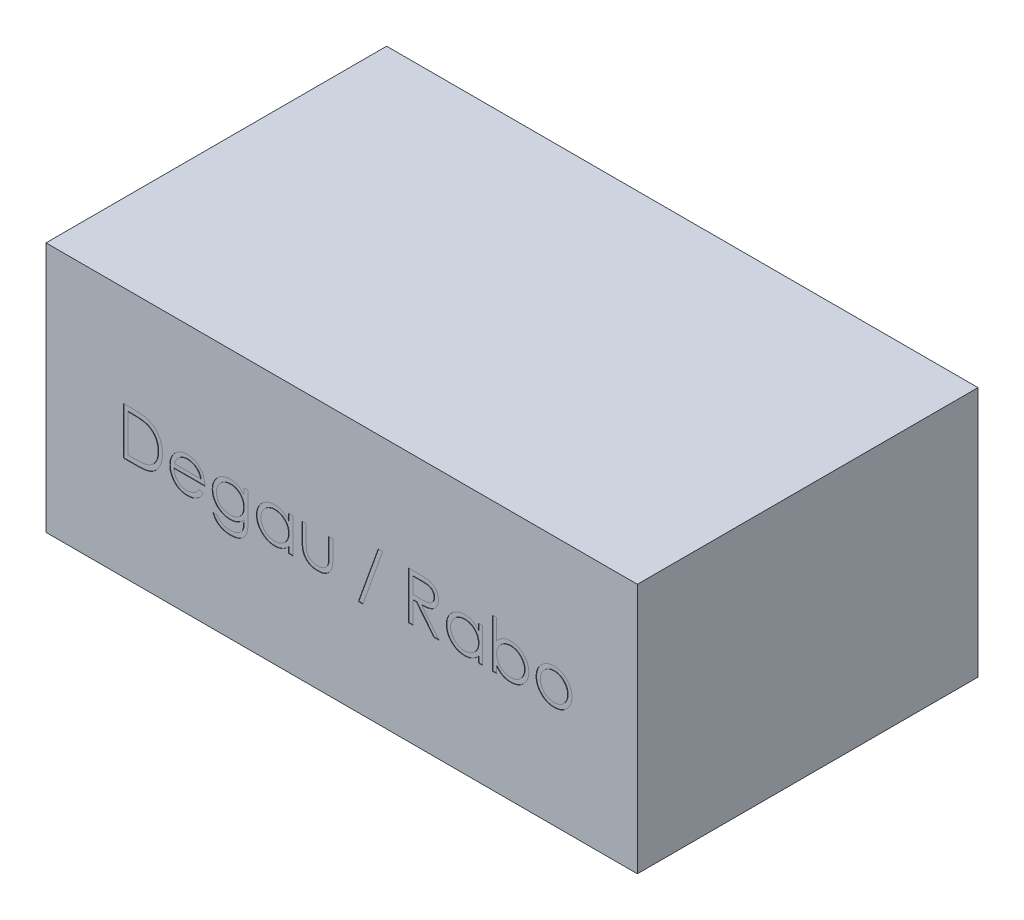
from build123d import *

# Parameters (mm, degrees)
ESQUISSE1_W             = 1250
ESQUISSE1_H             = 530
BOSS_EXTRU_1_DEPTH      = 720
ENL_V_MAT_EXTRU_1_DEPTH = 1


with BuildPart() as part:
    # Esquisse1 → Boss.-Extru.1 (new body)
    with BuildSketch(Plane.XY):
        with Locations((625, 265)):
            Rectangle(ESQUISSE1_W, ESQUISSE1_H)
    extrude(amount=BOSS_EXTRU_1_DEPTH)

    # Esquisse2 → Enlèv. mat.-Extru.1 (cut)
    # profile 1 of 10: a face of its own
    with BuildSketch(Plane.XY.offset(720)):
        with BuildLine():
            Line((164.157647169, 217.891840337), (164.157647169, 317.891840337))
            Line((164.157647169, 317.891840337), (184.349954861, 317.891840337))
            add(Edge.make_bspline(
                [(184.349954861, 317.891840337), (186.106211667, 317.87919548), (189.499290676, 317.854765682), (194.40250346, 317.699868792), (198.939182388, 317.425855482), (203.094406933, 317.026726164), (206.879584419, 316.536639489), (210.284116079, 315.922342222), (213.325605876, 315.196965926), (215.196161322, 314.57852449), (216.080724092, 314.286071106)],
                knots=[0, 0, 0, 0, 1.314313732, 2.53924729, 3.670748893, 4.714932338, 5.66265055, 6.526160246, 7.303039223, 8, 8, 8, 8], degree=3))
            add(Edge.make_bspline(
                [(216.080724092, 314.286071106), (217.237716644, 313.845193802), (219.525464995, 312.973436828), (222.782811354, 311.328971076), (225.849250296, 309.465739598), (228.741225863, 307.381286378), (231.392678046, 305.016590707), (233.907189382, 302.472102546), (236.181895776, 299.655292826), (238.264989948, 296.624578883), (240.143151647, 293.415663106), (241.775699014, 290.03466), (243.131527395, 286.49873977), (244.257048155, 282.817735541), (245.144089799, 278.983553318), (245.749287848, 274.991728574), (246.148458987, 270.858037448), (246.188574739, 268.05305277), (246.20892922, 266.629821106)],
                knots=[0, 0, 0, 0, 0.984719456, 1.947108742, 2.898477687, 3.838006223, 4.779231079, 5.722358779, 6.681677486, 7.655904652, 8.64651281, 9.637519902, 10.640069247, 11.656948941, 12.698408672, 13.768548281, 14.867775369, 16, 16, 16, 16], degree=3))
            add(Edge.make_bspline(
                [(246.20892922, 266.629821106), (246.190958721, 265.393785721), (246.155545975, 262.958048894), (245.837565521, 259.368309019), (245.375384949, 255.885064124), (244.659836439, 252.524901265), (243.791193198, 249.258380754), (242.677931732, 246.12031663), (241.402631842, 243.081922078), (239.915492454, 240.184279909), (238.282881454, 237.4390407), (236.530831648, 234.851168468), (234.66121178, 232.457590702), (232.656193697, 230.251058929), (230.541687513, 228.234899546), (228.303849496, 226.392270536), (225.936905189, 224.759226112), (223.451455967, 223.271594449), (220.774995133, 221.973870005), (217.856827527, 220.875869725), (214.684508156, 219.965966429), (211.265823673, 219.206797978), (207.594867166, 218.604589331), (203.668039571, 218.200978118), (199.491374151, 217.928037184), (196.623395144, 217.904140231), (195.147230502, 217.891840337)],
                knots=[0, 0, 0, 0, 1.105936401, 2.179363191, 3.223086493, 4.248585256, 5.251745608, 6.245858792, 7.225916811, 8.198733463, 9.158002045, 10.082870192, 10.993790845, 11.873723703, 12.748670949, 13.606408763, 14.465103618, 15.319838547, 16.196477973, 17.123216899, 18.106603292, 19.147568657, 20.255746949, 21.433717677, 22.679120308, 24, 24, 24, 24], degree=3))
            Line((195.147230502, 217.891840337), (164.157647169, 217.891840337))
        make_face()
        with BuildLine():
            Line((173.132006143, 228.148250594), (184.610371528, 228.148250594))
            add(Edge.make_bspline(
                [(184.610371528, 228.148250594), (186.259753549, 228.155339061), (189.432119218, 228.168972781), (193.993776283, 228.288607156), (198.16175904, 228.484091085), (201.936659308, 228.757664737), (205.316345717, 229.11962517), (208.307881428, 229.52319382), (210.901460237, 230.025978128), (212.470872721, 230.481719825), (213.196108707, 230.692321106)],
                knots=[0, 0, 0, 0, 1.375205317, 2.645023457, 3.804390687, 4.853969522, 5.800190428, 6.637939096, 7.370582563, 8, 8, 8, 8], degree=3))
            add(Edge.make_bspline(
                [(213.196108707, 230.692321106), (214.108919053, 231.013794199), (215.912737286, 231.649062006), (218.509339721, 232.807852326), (220.930968425, 234.18048289), (223.219826291, 235.706262147), (225.343445017, 237.439005061), (227.326991197, 239.341033313), (229.166471236, 241.422026886), (230.842880036, 243.679402931), (232.343117294, 246.099111378), (233.642295277, 248.657363769), (234.780910466, 251.326129775), (235.67458454, 254.146391451), (236.375029802, 257.092935977), (236.871163744, 260.165970642), (237.180155871, 263.364921552), (237.216197241, 265.540696531), (237.234570246, 266.649853158)],
                knots=[0, 0, 0, 0, 0.998632004, 1.973411704, 2.929992603, 3.868527914, 4.809262121, 5.754881198, 6.702106254, 7.672490631, 8.653608572, 9.636854334, 10.631411391, 11.644891563, 12.686317036, 13.754757253, 14.855430412, 16, 16, 16, 16], degree=3))
            add(Edge.make_bspline(
                [(237.234570246, 266.649853158), (237.219904893, 267.819381166), (237.191094676, 270.116929291), (236.828971521, 273.488092013), (236.299784221, 276.730396314), (235.534536049, 279.844059039), (234.559368082, 282.835154816), (233.342378317, 285.687140821), (231.951903481, 288.430137075), (230.297522429, 291.000833239), (228.485648333, 293.432064928), (226.47485178, 295.65934823), (224.297079251, 297.68775681), (221.976083552, 299.548880029), (219.446452145, 301.167842197), (216.767775265, 302.616033085), (213.900756089, 303.845058552), (211.906107636, 304.498740345), (210.89242281, 304.830942901)],
                knots=[0, 0, 0, 0, 1.122418816, 2.205001699, 3.251619955, 4.274784885, 5.280384055, 6.268708349, 7.249350384, 8.229342522, 9.199999885, 10.157847722, 11.105861043, 12.055065948, 13.010012805, 13.98527497, 14.976112212, 16, 16, 16, 16], degree=3))
            add(Edge.make_bspline(
                [(210.89242281, 304.830942901), (210.053818628, 305.06284084), (208.270716048, 305.555919485), (205.361017076, 306.093787271), (202.086298521, 306.568201529), (198.432021347, 306.969859796), (194.402351087, 307.258068977), (189.994188573, 307.474392252), (185.205628442, 307.620296037), (181.886127475, 307.6302591), (180.163256143, 307.635430081)],
                knots=[0, 0, 0, 0, 0.674548936, 1.434276114, 2.292660221, 3.240891867, 4.284742987, 5.42552168, 6.663806718, 8, 8, 8, 8], degree=3))
            Line((180.163256143, 307.635430081), (173.132006143, 307.635430081))
            Line((173.132006143, 307.635430081), (173.132006143, 228.148250594))
        make_face(mode=Mode.SUBTRACT)
    # profile 2 of 10: a face of its own
    with BuildSketch(Plane.XY.offset(720)):
        with BuildLine():
            Line((324.133608707, 240.968763414), (332.106365118, 236.782064696))
            add(Edge.make_bspline(
                [(332.106365118, 236.782064696), (331.471033825, 235.655112374), (330.234930726, 233.462509436), (328.109195072, 230.450170566), (325.880850141, 227.740235827), (323.449308198, 225.405102848), (320.887317371, 223.369348991), (318.180670091, 221.588268285), (315.315275299, 220.070596275), (312.290997448, 218.791952622), (309.082438844, 217.808824219), (305.681824089, 217.114417907), (302.082638507, 216.68518166), (299.615604796, 216.635320494), (298.352358707, 216.609789055)],
                knots=[0, 0, 0, 0, 1.120438281, 2.179929193, 3.190490725, 4.156257408, 5.095198341, 6.022838206, 6.959905092, 7.901321166, 8.864066838, 9.862729781, 10.905609505, 12, 12, 12, 12], degree=3))
            add(Edge.make_bspline(
                [(298.352358707, 216.609789055), (296.948302206, 216.642565493), (294.209394731, 216.706502828), (290.222544813, 217.257716098), (286.468847145, 218.156926346), (282.948512763, 219.413084674), (279.670162689, 221.053865363), (276.627281123, 223.0527077), (273.803866098, 225.399343548), (271.288888693, 228.114099076), (269.024777759, 231.019297856), (267.026897188, 234.046608842), (265.356684872, 237.188415255), (263.998038867, 240.424715942), (262.90075701, 243.7351129), (262.135994045, 247.14972626), (261.695144103, 250.659314381), (261.627588516, 253.033523973), (261.593544605, 254.229981363)],
                knots=[0, 0, 0, 0, 1.145258523, 2.234067595, 3.276747158, 4.290159414, 5.277019952, 6.260822364, 7.254936242, 8.264827045, 9.274100331, 10.257902744, 11.220704747, 12.172965371, 13.118907548, 14.062713208, 15.023725156, 16, 16, 16, 16], degree=3))
            add(Edge.make_bspline(
                [(261.593544605, 254.229981363), (261.623805786, 255.352690803), (261.68377945, 257.577752651), (262.061801947, 260.871053924), (262.731753177, 264.071866853), (263.651076719, 267.182851081), (264.838255181, 270.198797766), (266.290604302, 273.121542441), (268.010386524, 275.947975008), (269.338177203, 277.730921686), (270.007006143, 278.629019824)],
                knots=[0, 0, 0, 0, 1.024358464, 2.0301432, 3.019427413, 4.004406732, 4.986367066, 5.972626655, 6.978780325, 8, 8, 8, 8], degree=3))
            add(Edge.make_bspline(
                [(270.007006143, 278.629019824), (270.912939937, 279.710987541), (272.69610984, 281.840648983), (275.712005707, 284.638886862), (278.977725603, 286.982994724), (282.452343491, 288.926055757), (286.17624275, 290.402445671), (290.099365351, 291.502662306), (294.266382101, 292.119176907), (297.115102696, 292.206257868), (298.572711272, 292.250814696)],
                knots=[0, 0, 0, 0, 1.030682036, 2.02871468, 2.997146059, 3.962720338, 4.930598197, 5.918074684, 6.934738563, 8, 8, 8, 8], degree=3))
            add(Edge.make_bspline(
                [(298.572711272, 292.250814696), (300.07121428, 292.212127585), (303.010935593, 292.136232292), (307.297567622, 291.432622766), (311.353588095, 290.316835492), (315.177373932, 288.741012907), (318.769312811, 286.707882855), (322.106057085, 284.189544527), (325.244671729, 281.263313464), (327.070631125, 279.012936052), (327.999794605, 277.867801876)],
                knots=[0, 0, 0, 0, 1.056321875, 2.072262726, 3.055038591, 4.01806755, 4.982017516, 5.957941055, 6.960871419, 8, 8, 8, 8], degree=3))
            add(Edge.make_bspline(
                [(327.999794605, 277.867801876), (328.631992842, 277.004842407), (329.892181217, 275.284667588), (331.470669789, 272.479777385), (332.840881074, 269.545188975), (333.936108532, 266.433466201), (334.822951423, 263.181478196), (335.464574816, 259.765976918), (335.840849632, 256.187979451), (335.914812414, 253.750077866), (335.952518964, 252.507224952)],
                knots=[0, 0, 0, 0, 0.94817472, 1.890038105, 2.849395472, 3.817997239, 4.812318967, 5.836947057, 6.897266129, 8, 8, 8, 8], degree=3))
            Line((335.952518964, 252.507224952), (270.567903579, 252.507224952))
            add(Edge.make_bspline(
                [(270.567903579, 252.507224952), (270.611892334, 251.544354545), (270.698394447, 249.650908724), (271.101684252, 246.880314922), (271.737363503, 244.241076574), (272.630765292, 241.752989661), (273.712675157, 239.383557446), (275.037981351, 237.15035639), (276.619111464, 235.063558388), (278.382702875, 233.104497314), (280.345762741, 231.359904138), (282.41098409, 229.798424817), (284.60794309, 228.489693482), (286.919316904, 227.427410917), (289.341367908, 226.595801887), (291.874859197, 226.028149868), (294.514805379, 225.647946814), (296.31439778, 225.605670665), (297.230563836, 225.584148029)],
                knots=[0, 0, 0, 0, 1.094153842, 2.151609401, 3.174256925, 4.172055639, 5.149267565, 6.128595816, 7.11444997, 8.118368179, 9.117203808, 10.09244225, 11.054858984, 12.015122123, 12.976791628, 13.957293641, 14.960065497, 16, 16, 16, 16], degree=3))
            add(Edge.make_bspline(
                [(297.230563836, 225.584148029), (298.12631091, 225.601521077), (299.903644937, 225.635992536), (302.550526575, 225.97118999), (305.154513072, 226.513197865), (307.70482688, 227.252911867), (310.149708192, 228.155107642), (312.413866765, 229.243760718), (314.49615864, 230.448039196), (316.442357685, 231.825458483), (318.330100352, 233.511406683), (320.202742821, 235.615284426), (322.210647203, 238.103499505), (323.46749271, 239.976232819), (324.133608707, 240.968763414)],
                knots=[0, 0, 0, 0, 0.99110716, 1.966546729, 2.947904876, 3.932708344, 4.903319531, 5.828989031, 6.710028674, 7.56322171, 8.463672341, 9.504779593, 10.677557249, 12, 12, 12, 12], degree=3))
        make_face()
        with BuildLine():
            add(Edge.make_bspline(
                [(326.97815999, 261.481583927), (326.649685002, 262.671951748), (326.017476388, 264.963026621), (324.696437404, 268.135623491), (323.208679099, 270.955277806), (321.448058202, 273.400410179), (319.45323747, 275.571939121), (317.149089394, 277.469612983), (314.565206723, 279.167254442), (311.714945561, 280.600182998), (308.696608844, 281.819893247), (305.536431931, 282.637753697), (302.311923706, 283.198026334), (300.130944096, 283.250200861), (299.033448451, 283.276455722)],
                knots=[0, 0, 0, 0, 1.154881502, 2.222775134, 3.210006277, 4.132804581, 5.035138423, 5.962687519, 6.919655026, 7.923214229, 8.944639381, 9.960483929, 10.97369054, 12, 12, 12, 12], degree=3))
            add(Edge.make_bspline(
                [(299.033448451, 283.276455722), (298.137750208, 283.258979392), (296.367143092, 283.224432362), (293.758541144, 282.896714381), (291.253406889, 282.355004528), (288.833255814, 281.613148625), (286.529802432, 280.62433141), (284.295666197, 279.46481065), (282.187654876, 278.049336827), (280.869332148, 276.970512403), (280.203320246, 276.425494183)],
                knots=[0, 0, 0, 0, 1.04873581, 2.073130211, 3.073294108, 4.04793562, 5.032784715, 6.005352987, 6.992311501, 8, 8, 8, 8], degree=3))
            add(Edge.make_bspline(
                [(280.203320246, 276.425494183), (279.726369333, 275.994228023), (278.761136926, 275.121450421), (277.471407741, 273.617758805), (276.236537093, 271.996285601), (275.112718442, 270.194996326), (274.081930258, 268.234402641), (273.117359481, 266.131041634), (272.249176279, 263.868952198), (271.760715992, 262.292596791), (271.50940999, 261.481583927)],
                knots=[0, 0, 0, 0, 0.879870761, 1.780643979, 2.707998968, 3.669668524, 4.684282772, 5.740141944, 6.837334558, 8, 8, 8, 8], degree=3))
            Line((271.50940999, 261.481583927), (326.97815999, 261.481583927))
        make_face(mode=Mode.SUBTRACT)
    # profile 3 of 10: a face of its own
    with BuildSketch(Plane.XY.offset(720)):
        with BuildLine():
            Line((418.003801015, 290.968763414), (426.97815999, 290.968763414))
            Line((426.97815999, 290.968763414), (426.97815999, 232.975974952))
            add(Edge.make_bspline(
                [(426.97815999, 232.975974952), (426.970244487, 231.740615107), (426.954965662, 229.356073029), (426.844937912, 225.908122183), (426.612918563, 222.723376882), (426.349813381, 219.787312351), (425.971335772, 217.113537778), (425.509153851, 214.694074787), (424.988134446, 212.526601577), (424.530413948, 211.191606119), (424.313897169, 210.560109568)],
                knots=[0, 0, 0, 0, 1.307562039, 2.523909702, 3.650326591, 4.686913197, 5.643429486, 6.506965704, 7.293745905, 8, 8, 8, 8], degree=3))
            add(Edge.make_bspline(
                [(424.313897169, 210.560109568), (423.994204634, 209.739254665), (423.364378164, 208.122087893), (422.184788636, 205.829678727), (420.863819962, 203.671210446), (419.355055658, 201.658711837), (417.6653184, 199.80228577), (415.834418624, 198.061600076), (413.826698869, 196.473481008), (411.643307092, 195.065329652), (409.334574714, 193.797128105), (406.901828941, 192.698654757), (404.358787845, 191.741887796), (401.681562371, 191.025236489), (398.9121271, 190.404244473), (396.017914784, 190.000110593), (393.015834875, 189.72505179), (390.974538301, 189.699616562), (389.938897169, 189.686712132)],
                knots=[0, 0, 0, 0, 0.981931301, 1.934503488, 2.87077864, 3.801706999, 4.735015492, 5.667491629, 6.616593066, 7.585388521, 8.561939025, 9.551802639, 10.560317337, 11.588439944, 12.640189604, 13.723962949, 14.845264515, 16, 16, 16, 16], degree=3))
            add(Edge.make_bspline(
                [(389.938897169, 189.686712132), (388.427904752, 189.711183155), (385.476530602, 189.758981638), (381.173530811, 190.315864926), (377.086824528, 191.103132728), (373.270411479, 192.294716375), (369.748408711, 193.752916082), (366.544869411, 195.427057595), (363.688552053, 197.346752132), (361.113589967, 199.532483587), (358.789544535, 202.131445919), (356.603050535, 205.194270037), (354.498452196, 208.767609727), (353.265062543, 211.390258676), (352.619185631, 212.763635209)],
                knots=[0, 0, 0, 0, 1.157897085, 2.2616841, 3.32207898, 4.345638746, 5.321241055, 6.241986252, 7.112515963, 7.955008012, 8.825025602, 9.77857164, 10.836726669, 12, 12, 12, 12], degree=3))
            Line((352.619185631, 212.763635209), (361.593544605, 212.763635209))
            add(Edge.make_bspline(
                [(361.593544605, 212.763635209), (362.315322014, 211.617753044), (363.726307968, 209.377694515), (366.364835996, 206.477318632), (369.25644532, 203.998651069), (372.498721982, 202.001200382), (376.105156708, 200.495206342), (380.07791917, 199.421626443), (384.449336934, 198.778875962), (387.492714482, 198.701410415), (389.077518964, 198.661071106)],
                knots=[0, 0, 0, 0, 0.997731894, 1.950442991, 2.880492273, 3.800895997, 4.748200782, 5.754801363, 6.83083817, 8, 8, 8, 8], degree=3))
            add(Edge.make_bspline(
                [(389.077518964, 198.661071106), (390.642287259, 198.7019325), (393.659003907, 198.780709178), (397.997037308, 199.421913298), (401.956892681, 200.495439976), (405.515755556, 201.998536726), (408.631634657, 203.839976913), (411.317691551, 205.897121896), (413.493253727, 208.216579125), (414.956481346, 210.353202156), (415.866041849, 212.256748719), (416.445248613, 213.895394318), (416.915933455, 215.74833368), (417.309643099, 217.809354715), (417.634526338, 220.081402059), (417.840322977, 222.569670727), (417.98906045, 225.268505651), (417.998773874, 227.139738171), (418.003801015, 228.108186491)],
                knots=[0, 0, 0, 0, 1.570740765, 3.028230971, 4.391408896, 5.680370741, 6.894727393, 8.017376726, 9.065722033, 10.075533815, 10.603371122, 11.180248986, 11.817768598, 12.521299649, 13.286540596, 14.121245857, 15.027658897, 16, 16, 16, 16], degree=3))
            Line((418.003801015, 228.108186491), (418.003801015, 231.894244183))
            add(Edge.make_bspline(
                [(418.003801015, 231.894244183), (417.092911947, 230.810192693), (415.287156069, 228.661157846), (412.168661008, 225.845111083), (408.762463418, 223.419793075), (405.074362207, 221.430689232), (401.194698145, 219.839791386), (397.165491562, 218.72713536), (393.022861413, 218.008281077), (390.215657132, 217.930929185), (388.797070246, 217.891840337)],
                knots=[0, 0, 0, 0, 1.012485704, 2.007162095, 2.997754123, 3.998611389, 4.999708251, 5.992315798, 6.98544096, 8, 8, 8, 8], degree=3))
            add(Edge.make_bspline(
                [(388.797070246, 217.891840337), (387.961748262, 217.906555379), (386.300989475, 217.935811326), (383.833710983, 218.191776395), (381.402841316, 218.563169032), (379.014049784, 219.108353003), (376.663889411, 219.808116618), (374.356243922, 220.682880583), (372.072428877, 221.671883962), (369.853957509, 222.836821203), (367.722925203, 224.132887113), (365.695405627, 225.536855419), (363.782018796, 227.04137794), (362.000976241, 228.661290506), (360.354614199, 230.394248585), (358.820789398, 232.221778671), (357.424865196, 234.169399853), (356.138196932, 236.201598639), (355.022266921, 238.331910748), (354.04271344, 240.514142046), (353.191016153, 242.74362646), (352.512004675, 245.02782825), (351.993401439, 247.365307361), (351.607394954, 249.752234471), (351.388454049, 252.195959832), (351.354313362, 253.842284095), (351.337134348, 254.670686491)],
                knots=[0, 0, 0, 0, 1.028754217, 2.045334182, 3.052854819, 4.056607503, 5.061168794, 6.071104265, 7.095078842, 8.125279047, 9.155117945, 10.165957491, 11.161587969, 12.151493252, 13.128948131, 14.104219989, 15.088194871, 16.07871515, 17.064853787, 18.047899887, 19.02414258, 20.002704429, 20.980574569, 21.971845993, 22.979467364, 24, 24, 24, 24], degree=3))
            add(Edge.make_bspline(
                [(351.337134348, 254.670686491), (351.351967671, 255.499346377), (351.381576863, 257.153456628), (351.637319131, 259.607153353), (352.002124543, 262.02799436), (352.579489371, 264.39102698), (353.274418586, 266.723162745), (354.135092087, 269.007175785), (355.169913783, 271.24376176), (356.341620916, 273.434576944), (357.658309278, 275.550223085), (359.102094444, 277.559555825), (360.674719423, 279.447789308), (362.35448844, 281.23397279), (364.161911784, 282.900872597), (366.096054423, 284.444443022), (368.137851001, 285.890558058), (370.293629572, 287.208024834), (372.530126387, 288.373231878), (374.790521181, 289.436448933), (377.104756468, 290.280280919), (379.429686165, 291.023798034), (381.806255159, 291.550517898), (384.205323548, 291.956867667), (386.635104627, 292.204431125), (388.262330199, 292.235333553), (389.077518964, 292.250814696)],
                knots=[0, 0, 0, 0, 1.008818848, 2.013730394, 3.001654427, 3.987803273, 4.973046549, 5.963777569, 6.957074694, 7.972068341, 8.987420212, 9.989399531, 10.982630087, 11.977756091, 12.973280677, 13.973972381, 14.989194003, 16.018387222, 17.047741039, 18.059210846, 19.057554164, 20.045176975, 21.029480261, 22.018708529, 23.007435371, 24, 24, 24, 24], degree=3))
            add(Edge.make_bspline(
                [(389.077518964, 292.250814696), (390.421831506, 292.212052602), (393.076435715, 292.135509377), (396.983035785, 291.534905224), (400.75281407, 290.577361985), (404.407043089, 289.205486828), (407.975490261, 287.332628589), (411.446394698, 284.865687218), (414.829798532, 281.782534654), (416.917736547, 279.418167101), (418.003801015, 278.188314696)],
                knots=[0, 0, 0, 0, 0.96728863, 1.910097829, 2.838038873, 3.762875196, 4.71315279, 5.730631239, 6.819562287, 8, 8, 8, 8], degree=3))
            Line((418.003801015, 278.188314696), (418.003801015, 290.968763414))
        make_face()
        with BuildLine():
            add(Edge.make_bspline(
                [(389.79867281, 283.276455722), (388.486366985, 283.23185385), (385.888279717, 283.143551602), (382.08004136, 282.389702655), (378.403557547, 281.208391226), (374.929116741, 279.518602214), (371.674627887, 277.458766844), (368.786775874, 274.963330056), (366.260921128, 272.113438716), (364.124265748, 268.93486023), (362.423369563, 265.50565236), (361.219271864, 261.891059956), (360.440699771, 258.149488733), (360.354766855, 255.595985785), (360.311493323, 254.310109568)],
                knots=[0, 0, 0, 0, 1.026226791, 2.031711442, 3.026614839, 4.04107745, 5.047145931, 6.032893242, 7.017642609, 8.019221815, 9.021877557, 10.003543541, 10.994637589, 12, 12, 12, 12], degree=3))
            add(Edge.make_bspline(
                [(360.311493323, 254.310109568), (360.332229232, 253.340587495), (360.373010703, 251.433821095), (360.765112924, 248.635595532), (361.398854785, 245.970443714), (362.297060679, 243.438204444), (363.409994819, 241.024353161), (364.809776847, 238.745517883), (366.456947466, 236.599669138), (368.338614264, 234.60267823), (370.412225175, 232.783793418), (372.661345155, 231.185563685), (375.082923719, 229.87840023), (377.61740401, 228.748662013), (380.326282753, 227.923545786), (383.170542354, 227.293866385), (386.170305111, 226.93361617), (388.215211948, 226.888964804), (389.257807425, 226.866199311)],
                knots=[0, 0, 0, 0, 1.039728707, 2.044842319, 3.024901384, 3.974314358, 4.923051295, 5.871625912, 6.837440708, 7.820715446, 8.810779094, 9.792721783, 10.773906224, 11.758876063, 12.764959493, 13.806266761, 14.881525401, 16, 16, 16, 16], degree=3))
            add(Edge.make_bspline(
                [(389.257807425, 226.866199311), (390.313914802, 226.888130998), (392.379121587, 226.93101818), (395.395434055, 227.299689567), (398.253512352, 227.894603175), (400.950735848, 228.739261042), (403.49728845, 229.817025345), (405.864563153, 231.180928703), (408.103318812, 232.73419819), (410.142073371, 234.545970024), (411.985620958, 236.542684167), (413.592214297, 238.715395453), (414.961198555, 241.031410283), (416.094846265, 243.490467588), (416.960309241, 246.111677676), (417.540849384, 248.888487841), (417.946756389, 251.807594665), (417.984497094, 253.807840842), (418.003801015, 254.830942901)],
                knots=[0, 0, 0, 0, 1.121943988, 2.193949579, 3.223793937, 4.220241907, 5.192961521, 6.155822191, 7.11847367, 8.083710714, 9.04790392, 10.001595906, 10.949595423, 11.902125208, 12.873731292, 13.87582262, 14.913508608, 16, 16, 16, 16], degree=3))
            add(Edge.make_bspline(
                [(418.003801015, 254.830942901), (417.965527639, 256.162881586), (417.890754911, 258.765021729), (417.185121835, 262.556643671), (416.047401544, 266.121462922), (414.45178005, 269.448205089), (412.452294088, 272.501620795), (410.043984121, 275.225159209), (407.268383247, 277.622326539), (404.133466099, 279.619417783), (400.760681952, 281.232715909), (397.231504921, 282.443052256), (393.551174524, 283.128604114), (391.056705679, 283.226888207), (389.79867281, 283.276455722)],
                knots=[0, 0, 0, 0, 1.070913519, 2.092188694, 3.091357305, 4.074328408, 5.051968682, 6.018948707, 6.99050112, 7.9935919, 9.000589572, 9.992915277, 10.987769056, 12, 12, 12, 12], degree=3))
        make_face(mode=Mode.SUBTRACT)
    # profile 4 of 10: a face of its own
    with BuildSketch(Plane.XY.offset(720)):
        with BuildLine():
            Line((521.849954861, 290.968763414), (521.849954861, 217.891840337))
            Line((521.849954861, 217.891840337), (512.875595887, 217.891840337))
            Line((512.875595887, 217.891840337), (512.875595887, 230.532064696))
            add(Edge.make_bspline(
                [(512.875595887, 230.532064696), (511.86363044, 229.388076297), (509.888767147, 227.155568552), (506.59044949, 224.238935052), (503.094215836, 221.828125865), (499.417035232, 219.880985417), (495.56222828, 218.418355236), (491.538340072, 217.378750689), (487.34372919, 216.710355399), (484.479376196, 216.643611917), (483.027839477, 216.609789055)],
                knots=[0, 0, 0, 0, 1.074387032, 2.096679803, 3.090159297, 4.057316773, 5.018401886, 5.985159533, 6.978961417, 8, 8, 8, 8], degree=3))
            add(Edge.make_bspline(
                [(483.027839477, 216.609789055), (481.73732651, 216.644828263), (479.192377799, 216.713927132), (475.448689881, 217.249992949), (471.846054182, 218.110867853), (468.381066392, 219.308036125), (465.076147951, 220.8960596), (461.903002332, 222.797238116), (458.878068274, 225.061261832), (456.047452875, 227.649491214), (453.440824293, 230.460776562), (451.153359361, 233.459220758), (449.246128508, 236.631858012), (447.651269059, 239.938519552), (446.422802075, 243.40466011), (445.566412525, 247.01829348), (445.03097119, 250.775147009), (444.961900885, 253.333419098), (444.926877938, 254.630622388)],
                knots=[0, 0, 0, 0, 1.033919861, 2.038935746, 3.024066025, 3.998881131, 4.97069526, 5.957263378, 6.95902576, 7.993208707, 9.027059324, 10.027763471, 11.009749337, 11.988697705, 12.965288445, 13.950418724, 14.960734635, 16, 16, 16, 16], degree=3))
            add(Edge.make_bspline(
                [(444.926877938, 254.630622388), (444.962677121, 255.901013919), (445.033450173, 258.412509442), (445.560685026, 262.106186528), (446.447285273, 265.66385112), (447.691509492, 269.074049498), (449.28699392, 272.340908074), (451.227796406, 275.46673736), (453.514057112, 278.460148716), (456.149840169, 281.250755196), (459.005119317, 283.828487033), (462.059654486, 286.068745474), (465.237462523, 288.003512583), (468.587834253, 289.536469049), (472.061180105, 290.776729179), (475.688421412, 291.634813981), (479.454466517, 292.140451731), (482.011337718, 292.213673564), (483.308288195, 292.250814696)],
                knots=[0, 0, 0, 0, 1.020392517, 2.01726096, 2.990465484, 3.961182959, 4.928053699, 5.906110375, 6.912531644, 7.948652711, 8.985773172, 9.998621852, 10.987621588, 11.969261332, 12.953316658, 13.946091881, 14.958173133, 16, 16, 16, 16], degree=3))
            add(Edge.make_bspline(
                [(483.308288195, 292.250814696), (484.799712739, 292.209736081), (487.724325882, 292.129182854), (492.002269003, 291.458819217), (496.049254086, 290.326291584), (499.896521287, 288.78579164), (503.530255176, 286.738685095), (506.916054728, 284.156400494), (510.089354251, 281.055223724), (511.928791155, 278.673211025), (512.875595887, 277.447128799)],
                knots=[0, 0, 0, 0, 1.038897134, 2.037228247, 3.008116434, 3.962042015, 4.918381754, 5.904844433, 6.921570401, 8, 8, 8, 8], degree=3))
            Line((512.875595887, 277.447128799), (512.875595887, 290.968763414))
            Line((512.875595887, 290.968763414), (521.849954861, 290.968763414))
        make_face()
        with BuildLine():
            add(Edge.make_bspline(
                [(483.428480502, 283.276455722), (482.116642277, 283.229780358), (479.527282278, 283.137650614), (475.726025076, 282.418407894), (472.08849896, 281.221705198), (468.632896838, 279.585079451), (465.413804934, 277.527115547), (462.536842911, 275.037933168), (459.978480015, 272.185447049), (457.826815322, 268.982529609), (456.072801125, 265.548869864), (454.839457355, 261.959600204), (454.026050286, 258.279457988), (453.942949699, 255.783381252), (453.901236913, 254.530462132)],
                knots=[0, 0, 0, 0, 1.031046209, 2.035121221, 3.029706178, 4.034933723, 5.034054252, 6.02443088, 7.017295772, 8.038157696, 9.050218397, 10.03989886, 11.016116709, 12, 12, 12, 12], degree=3))
            add(Edge.make_bspline(
                [(453.901236913, 254.530462132), (453.954519579, 253.285030498), (454.060876061, 250.799048902), (454.825181615, 247.113889566), (456.107463713, 243.523774078), (457.857236934, 240.059174263), (460.048283354, 236.842485682), (462.587959142, 233.935625037), (465.500824322, 231.435922515), (468.727324524, 229.343420412), (472.173266536, 227.653062672), (475.797093149, 226.476901543), (479.530682811, 225.717536383), (482.069320921, 225.628837044), (483.348352297, 225.584148029)],
                knots=[0, 0, 0, 0, 0.979072187, 1.954306742, 2.945804271, 3.96968567, 4.997920485, 5.998718438, 6.996577872, 8.005894225, 9.015743152, 10.005417472, 10.995077863, 12, 12, 12, 12], degree=3))
            add(Edge.make_bspline(
                [(483.348352297, 225.584148029), (484.646823805, 225.63157557), (487.229354848, 225.725904245), (491.041889359, 226.44822611), (494.741745439, 227.641620349), (498.278523393, 229.295881113), (501.573269997, 231.346091281), (504.530352214, 233.746293882), (507.030808454, 236.537813428), (509.150597299, 239.605712087), (510.812752062, 242.968911986), (512.02349661, 246.549888864), (512.739322489, 250.348767383), (512.829543336, 252.944879581), (512.875595887, 254.270045465)],
                knots=[0, 0, 0, 0, 1.01762866, 2.023962475, 3.030623092, 4.058876274, 5.077231937, 6.066672613, 7.034107872, 8.005628644, 8.981990164, 9.965428785, 10.961468474, 12, 12, 12, 12], degree=3))
            add(Edge.make_bspline(
                [(512.875595887, 254.270045465), (512.848177133, 255.279697766), (512.79420835, 257.267013004), (512.381906363, 260.184942078), (511.726051323, 262.97733425), (510.801875037, 265.647125366), (509.587838339, 268.179554377), (508.123616457, 270.592804669), (506.38346075, 272.874324994), (504.395383718, 274.992698451), (502.219235074, 276.924883087), (499.916533913, 278.649575678), (497.459998286, 280.066397757), (494.890940088, 281.239005514), (492.204901961, 282.172124082), (489.380027109, 282.794629619), (486.446341768, 283.222067362), (484.4450259, 283.258135384), (483.428480502, 283.276455722)],
                knots=[0, 0, 0, 0, 1.050140795, 2.067009409, 3.05949893, 4.030605086, 5.00011959, 5.97591094, 6.962425594, 7.979863591, 8.993523472, 9.986985069, 10.967611495, 11.937549037, 12.921786183, 13.919465291, 14.943216303, 16, 16, 16, 16], degree=3))
        make_face(mode=Mode.SUBTRACT)
    # profile 5 of 10: a face of its own
    with BuildSketch(Plane.XY.offset(720)):
        with BuildLine():
            Line((541.080724092, 290.968763414), (550.055083066, 290.968763414))
            Line((550.055083066, 290.968763414), (550.055083066, 257.074532645))
            add(Edge.make_bspline(
                [(550.055083066, 257.074532645), (550.059137492, 256.079596954), (550.066893419, 254.176331581), (550.119491731, 251.43761196), (550.243208692, 248.939991598), (550.397889392, 246.682027691), (550.596807567, 244.664102217), (550.83347501, 242.893263445), (551.098001342, 241.349429614), (551.356936027, 240.419619451), (551.477358707, 239.987192901)],
                knots=[0, 0, 0, 0, 1.388932606, 2.656963016, 3.823490214, 4.879454478, 5.816252168, 6.653371382, 7.373723809, 8, 8, 8, 8], degree=3))
            add(Edge.make_bspline(
                [(551.477358707, 239.987192901), (551.670543136, 239.443682302), (552.052895737, 238.367960557), (552.746423844, 236.81398898), (553.604376318, 235.374695196), (554.543228543, 233.994578833), (555.62606876, 232.714522064), (556.839196506, 231.536686532), (558.142003278, 230.416569639), (560.077861089, 229.091289869), (562.725268688, 227.670851864), (566.201061698, 226.445257053), (569.969753866, 225.712805053), (572.574460131, 225.627826338), (573.913256143, 225.584148029)],
                knots=[0, 0, 0, 0, 0.725840625, 1.436591201, 2.137033971, 2.831655856, 3.53531722, 4.242432219, 4.957935707, 5.694543706, 7.190802206, 8.724350549, 10.316345118, 12, 12, 12, 12], degree=3))
            add(Edge.make_bspline(
                [(573.913256143, 225.584148029), (575.251927792, 225.628755132), (577.842009744, 225.715061623), (581.56929458, 226.423162726), (584.97647785, 227.606182412), (588.029362173, 229.257822749), (590.714100463, 231.279024544), (592.951369571, 233.650704793), (594.797291129, 236.297830132), (595.603274576, 238.272809528), (596.008608707, 239.266039055)],
                knots=[0, 0, 0, 0, 1.157059328, 2.238695713, 3.266970494, 4.264342957, 5.228770407, 6.160125903, 7.074715775, 8, 8, 8, 8], degree=3))
            add(Edge.make_bspline(
                [(596.008608707, 239.266039055), (596.128443852, 239.66507616), (596.393370091, 240.547249743), (596.678008705, 242.043813982), (596.934421894, 243.82851697), (597.153369783, 245.913037217), (597.309517287, 248.291927288), (597.393689475, 250.964443749), (597.488783053, 253.922196896), (597.490226375, 255.992704306), (597.490980502, 257.074532645)],
                knots=[0, 0, 0, 0, 0.557542046, 1.232589297, 2.036731608, 2.971723315, 4.038036528, 5.22795436, 6.551621927, 8, 8, 8, 8], degree=3))
            Line((597.490980502, 257.074532645), (597.490980502, 290.968763414))
            Line((597.490980502, 290.968763414), (606.465339477, 290.968763414))
            Line((606.465339477, 290.968763414), (606.465339477, 255.391840337))
            add(Edge.make_bspline(
                [(606.465339477, 255.391840337), (606.452719625, 254.18306401), (606.428235386, 251.837872585), (606.270882715, 248.429755113), (606.000893782, 245.253690974), (605.591102783, 242.307998978), (605.109226365, 239.594928071), (604.487618566, 237.111001043), (603.745383202, 234.86387093), (602.908082774, 232.814105876), (601.918886559, 230.955623184), (600.866685972, 229.19174271), (599.651692491, 227.566230276), (598.372542941, 225.998169213), (596.949638488, 224.565554145), (595.409642517, 223.235511977), (593.774230522, 221.98771107), (592.007110579, 220.870817373), (590.13408021, 219.864627506), (588.152827152, 218.97273956), (586.039084346, 218.266951644), (583.82012329, 217.65807548), (581.485072452, 217.180519219), (579.036182936, 216.843760169), (576.474279613, 216.637322142), (574.728295051, 216.619120861), (573.833127938, 216.609789055)],
                knots=[0, 0, 0, 0, 1.493040784, 2.896703357, 4.213163133, 5.428574705, 6.569057535, 7.615249723, 8.588095153, 9.490268104, 10.346124644, 11.18633936, 12.024365274, 12.850166724, 13.684164916, 14.514361689, 15.362232829, 16.222528818, 17.093394965, 17.986930858, 18.902426812, 19.842810585, 20.827885679, 21.843828298, 22.894529745, 24, 24, 24, 24], degree=3))
            add(Edge.make_bspline(
                [(573.833127938, 216.609789055), (572.944656107, 216.619494973), (571.198726248, 216.638568007), (568.636690697, 216.842619655), (566.181016232, 217.17999596), (563.840433417, 217.661573599), (561.612593494, 218.262689883), (559.488472354, 218.977076611), (557.492941983, 219.865090375), (555.602027583, 220.86444916), (553.830530777, 221.9948856), (552.170285689, 223.233972447), (550.623518473, 224.579859963), (549.189887959, 226.02692731), (547.889517199, 227.593125492), (546.706201723, 229.265855786), (545.621724432, 231.028544031), (544.640216136, 232.916062959), (543.797023121, 234.989548952), (543.052587524, 237.283751726), (542.443712141, 239.823823635), (541.948213045, 242.607593019), (541.549600457, 245.621737065), (541.272853536, 248.883691788), (541.118115514, 252.385511564), (541.093456617, 254.804079851), (541.080724092, 256.052898029)],
                knots=[0, 0, 0, 0, 1.083640291, 2.129454052, 3.13281866, 4.105697902, 5.042300162, 5.946461698, 6.836384745, 7.703652036, 8.553297018, 9.397182691, 10.228592656, 11.052265423, 11.879314572, 12.708807002, 13.549817954, 14.402308542, 15.300838682, 16.27712199, 17.341985831, 18.484375296, 19.725102775, 21.0496083, 22.476576903, 24, 24, 24, 24], degree=3))
            Line((541.080724092, 256.052898029), (541.080724092, 290.968763414))
        make_face()
    # profile 6 of 10: a face of its own
    with BuildSketch(Plane.XY.offset(720)):
        Polygon((711.593544605, 320.455942901), (669.766621528, 203.789276235), (660.311493323, 203.789276235), (702.1384164, 320.455942901), align=None)
    # profile 7 of 10: a face of its own
    with BuildSketch(Plane.XY.offset(720)):
        with BuildLine():
            Line((766.721749733, 317.891840337), (786.733768964, 317.891840337))
            add(Edge.make_bspline(
                [(786.733768964, 317.891840337), (788.069229779, 317.887395023), (790.633462476, 317.878859528), (794.306984486, 317.831266302), (797.644901543, 317.694856139), (800.645468381, 317.57746804), (803.308629952, 317.363412573), (805.642552545, 317.158822656), (807.636486759, 316.891003776), (808.843511082, 316.642277406), (809.390018964, 316.52966085)],
                knots=[0, 0, 0, 0, 1.410062039, 2.707475311, 3.878576406, 4.937260626, 5.877586885, 6.699081471, 7.410979367, 8, 8, 8, 8], degree=3))
            add(Edge.make_bspline(
                [(809.390018964, 316.52966085), (810.121636796, 316.348896125), (811.569265067, 315.991222878), (813.653552668, 315.235234283), (815.63967621, 314.360387865), (817.519385476, 313.332852999), (819.283265224, 312.145002151), (820.949502675, 310.81734151), (822.525658772, 309.357135631), (823.947991063, 307.727568731), (825.289106826, 306.017954169), (826.42021044, 304.169275402), (827.395252718, 302.236088901), (828.171553203, 300.198734108), (828.79663816, 298.076969198), (829.237387856, 295.851575005), (829.501707503, 293.532690003), (829.528617661, 291.951035466), (829.542262554, 291.149051876)],
                knots=[0, 0, 0, 0, 1.027469482, 2.033020251, 3.019912614, 3.986113645, 4.951240523, 5.91722682, 6.890402269, 7.87763091, 8.8651537, 9.85103654, 10.82876324, 11.815024772, 12.821070561, 13.842952187, 14.906261191, 16, 16, 16, 16], degree=3))
            add(Edge.make_bspline(
                [(829.542262554, 291.149051876), (829.500291179, 289.816620315), (829.418394157, 287.216701233), (828.654819766, 283.443533192), (827.404062059, 279.923838488), (825.680539516, 276.662048834), (823.485697353, 273.721744681), (820.847846178, 271.139160243), (817.765514422, 268.978019884), (814.896105395, 267.479368321), (812.361413975, 266.519570931), (810.274747895, 265.844246393), (807.998548538, 265.322475956), (805.554624692, 264.85504362), (802.932805964, 264.502138065), (800.139376267, 264.243663938), (797.172343363, 264.082119689), (795.134084239, 264.058062406), (794.085531784, 264.045686491)],
                knots=[0, 0, 0, 0, 1.260483769, 2.459530307, 3.627416485, 4.787058657, 5.939039949, 7.08810263, 8.267026773, 9.491475466, 10.141966685, 10.831826277, 11.566392101, 12.351337768, 13.187381173, 14.07005841, 15.007169909, 16, 16, 16, 16], degree=3))
            Line((794.085531784, 264.045686491), (830.824313836, 217.891840337))
            Line((830.824313836, 217.891840337), (819.726557425, 217.891840337))
            Line((819.726557425, 217.891840337), (782.987775374, 264.045686491))
            Line((782.987775374, 264.045686491), (775.696108707, 264.045686491))
            Line((775.696108707, 264.045686491), (775.696108707, 217.891840337))
            Line((775.696108707, 217.891840337), (766.721749733, 217.891840337))
            Line((766.721749733, 217.891840337), (766.721749733, 317.891840337))
        make_face()
        with BuildLine():
            Line((775.696108707, 307.635430081), (775.696108707, 274.302096747))
            Line((775.696108707, 274.302096747), (794.005403579, 274.161872388))
            add(Edge.make_bspline(
                [(794.005403579, 274.161872388), (794.860261834, 274.161494198), (796.517220609, 274.160761158), (798.914382461, 274.274869051), (801.146385652, 274.404678143), (803.204692857, 274.603230873), (805.09022358, 274.859118637), (806.802035387, 275.179203901), (808.342922584, 275.552119976), (810.140023681, 276.129309285), (812.14678172, 277.04376695), (814.327680574, 278.37420977), (816.184890224, 280.047613174), (817.753972004, 281.96114049), (819.014812903, 284.065033314), (819.903728741, 286.334072434), (820.467798521, 288.710975234), (820.534328391, 290.344635458), (820.567903579, 291.169083927)],
                knots=[0, 0, 0, 0, 1.146690395, 2.22261258, 3.21895312, 4.145990853, 4.996080663, 5.770904154, 6.481378293, 7.121626537, 8.300444488, 9.431385265, 10.535395872, 11.636531494, 12.74115979, 13.810798291, 14.895190096, 16, 16, 16, 16], degree=3))
            add(Edge.make_bspline(
                [(820.567903579, 291.169083927), (820.533557262, 291.973271748), (820.465495395, 293.566878567), (819.909816294, 295.899904575), (818.970119684, 298.101817436), (817.703770029, 300.163659865), (816.16093703, 302.035252318), (814.351856668, 303.636599548), (812.325993949, 304.958012824), (810.432531139, 305.802423696), (808.740125068, 306.320133789), (807.270706209, 306.684452755), (805.610378275, 306.977151867), (803.751079457, 307.211667892), (801.700747149, 307.413237728), (799.449014261, 307.549002832), (797.010820539, 307.62939895), (795.320908219, 307.633372918), (794.446108707, 307.635430081)],
                knots=[0, 0, 0, 0, 1.101028733, 2.181837193, 3.264309656, 4.369019818, 5.486613113, 6.575447106, 7.666700264, 8.788928104, 9.402425223, 10.0903467, 10.862060571, 11.710948788, 12.657782767, 13.684531032, 14.801375019, 16, 16, 16, 16], degree=3))
            Line((794.446108707, 307.635430081), (775.696108707, 307.635430081))
        make_face(mode=Mode.SUBTRACT)
    # profile 8 of 10: a face of its own
    with BuildSketch(Plane.XY.offset(720)):
        with BuildLine():
            Line((923.132006143, 290.968763414), (923.132006143, 217.891840337))
            Line((923.132006143, 217.891840337), (914.157647169, 217.891840337))
            Line((914.157647169, 217.891840337), (914.157647169, 230.532064696))
            add(Edge.make_bspline(
                [(914.157647169, 230.532064696), (913.145681723, 229.388076297), (911.170818429, 227.155568552), (907.872500772, 224.238935052), (904.376267118, 221.828125865), (900.699086514, 219.880985417), (896.844279562, 218.418355236), (892.820391354, 217.378750689), (888.625780472, 216.710355399), (885.761427478, 216.643611917), (884.309890759, 216.609789055)],
                knots=[0, 0, 0, 0, 1.074387032, 2.096679803, 3.090159297, 4.057316773, 5.018401886, 5.985159533, 6.978961417, 8, 8, 8, 8], degree=3))
            add(Edge.make_bspline(
                [(884.309890759, 216.609789055), (883.019377792, 216.644828263), (880.474429081, 216.713927132), (876.730741163, 217.249992949), (873.128105464, 218.110867853), (869.663117674, 219.308036125), (866.358199233, 220.8960596), (863.185053614, 222.797238116), (860.160119556, 225.061261832), (857.329504157, 227.649491214), (854.722875575, 230.460776562), (852.435410643, 233.459220758), (850.52817979, 236.631858012), (848.933320341, 239.938519552), (847.704853357, 243.40466011), (846.848463807, 247.01829348), (846.313022472, 250.775147009), (846.243952167, 253.333419098), (846.20892922, 254.630622388)],
                knots=[0, 0, 0, 0, 1.033919861, 2.038935746, 3.024066025, 3.998881131, 4.97069526, 5.957263378, 6.95902576, 7.993208707, 9.027059324, 10.027763471, 11.009749337, 11.988697705, 12.965288445, 13.950418724, 14.960734635, 16, 16, 16, 16], degree=3))
            add(Edge.make_bspline(
                [(846.20892922, 254.630622388), (846.244728403, 255.901013919), (846.315501455, 258.412509442), (846.842736308, 262.106186528), (847.729336555, 265.66385112), (848.973560774, 269.074049498), (850.569045202, 272.340908074), (852.509847688, 275.46673736), (854.796108394, 278.460148716), (857.431891451, 281.250755196), (860.287170599, 283.828487033), (863.341705768, 286.068745474), (866.519513806, 288.003512583), (869.869885535, 289.536469049), (873.343231387, 290.776729179), (876.970472694, 291.634813981), (880.736517799, 292.140451731), (883.293389, 292.213673564), (884.590339477, 292.250814696)],
                knots=[0, 0, 0, 0, 1.020392517, 2.01726096, 2.990465484, 3.961182959, 4.928053699, 5.906110375, 6.912531644, 7.948652711, 8.985773172, 9.998621852, 10.987621588, 11.969261332, 12.953316658, 13.946091881, 14.958173133, 16, 16, 16, 16], degree=3))
            add(Edge.make_bspline(
                [(884.590339477, 292.250814696), (886.081764021, 292.209736081), (889.006377164, 292.129182854), (893.284320286, 291.458819217), (897.331305369, 290.326291584), (901.178572569, 288.78579164), (904.812306458, 286.738685095), (908.19810601, 284.156400494), (911.371405533, 281.055223724), (913.210842437, 278.673211025), (914.157647169, 277.447128799)],
                knots=[0, 0, 0, 0, 1.038897134, 2.037228247, 3.008116434, 3.962042015, 4.918381754, 5.904844433, 6.921570401, 8, 8, 8, 8], degree=3))
            Line((914.157647169, 277.447128799), (914.157647169, 290.968763414))
            Line((914.157647169, 290.968763414), (923.132006143, 290.968763414))
        make_face()
        with BuildLine():
            add(Edge.make_bspline(
                [(884.710531784, 283.276455722), (883.398693559, 283.229780358), (880.80933356, 283.137650614), (877.008076359, 282.418407894), (873.370550242, 281.221705198), (869.91494812, 279.585079451), (866.695856216, 277.527115547), (863.818894193, 275.037933168), (861.260531297, 272.185447049), (859.108866604, 268.982529609), (857.354852407, 265.548869864), (856.121508637, 261.959600204), (855.308101568, 258.279457988), (855.225000981, 255.783381252), (855.183288195, 254.530462132)],
                knots=[0, 0, 0, 0, 1.031046209, 2.035121221, 3.029706178, 4.034933723, 5.034054252, 6.02443088, 7.017295772, 8.038157696, 9.050218397, 10.03989886, 11.016116709, 12, 12, 12, 12], degree=3))
            add(Edge.make_bspline(
                [(855.183288195, 254.530462132), (855.236570861, 253.285030498), (855.342927343, 250.799048902), (856.107232897, 247.113889566), (857.389514995, 243.523774078), (859.139288216, 240.059174263), (861.330334637, 236.842485682), (863.870010424, 233.935625037), (866.782875604, 231.435922515), (870.009375806, 229.343420412), (873.455317818, 227.653062672), (877.079144431, 226.476901543), (880.812734093, 225.717536383), (883.351372203, 225.628837044), (884.630403579, 225.584148029)],
                knots=[0, 0, 0, 0, 0.979072187, 1.954306742, 2.945804271, 3.96968567, 4.997920485, 5.998718438, 6.996577872, 8.005894225, 9.015743152, 10.005417472, 10.995077863, 12, 12, 12, 12], degree=3))
            add(Edge.make_bspline(
                [(884.630403579, 225.584148029), (885.928875087, 225.63157557), (888.51140613, 225.725904245), (892.323940641, 226.44822611), (896.023796721, 227.641620349), (899.560574675, 229.295881113), (902.855321279, 231.346091281), (905.812403497, 233.746293882), (908.312859736, 236.537813428), (910.432648581, 239.605712087), (912.094803344, 242.968911986), (913.305547892, 246.549888864), (914.021373771, 250.348767383), (914.111594618, 252.944879581), (914.157647169, 254.270045465)],
                knots=[0, 0, 0, 0, 1.01762866, 2.023962475, 3.030623092, 4.058876274, 5.077231937, 6.066672613, 7.034107872, 8.005628644, 8.981990164, 9.965428785, 10.961468474, 12, 12, 12, 12], degree=3))
            add(Edge.make_bspline(
                [(914.157647169, 254.270045465), (914.130228416, 255.279697766), (914.076259632, 257.267013004), (913.663957645, 260.184942078), (913.008102605, 262.97733425), (912.083926319, 265.647125366), (910.869889621, 268.179554377), (909.405667739, 270.592804669), (907.665512032, 272.874324994), (905.677435001, 274.992698451), (903.501286356, 276.924883087), (901.198585195, 278.649575678), (898.742049568, 280.066397757), (896.17299137, 281.239005514), (893.486953243, 282.172124082), (890.662078391, 282.794629619), (887.72839305, 283.222067362), (885.727077182, 283.258135384), (884.710531784, 283.276455722)],
                knots=[0, 0, 0, 0, 1.050140795, 2.067009409, 3.05949893, 4.030605086, 5.00011959, 5.97591094, 6.962425594, 7.979863591, 8.993523472, 9.986985069, 10.967611495, 11.937549037, 12.921786183, 13.919465291, 14.943216303, 16, 16, 16, 16], degree=3))
        make_face(mode=Mode.SUBTRACT)
    # profile 9 of 10: a face of its own
    with BuildSketch(Plane.XY.offset(720)):
        with BuildLine():
            Line((943.644826656, 217.891840337), (943.644826656, 320.455942901))
            Line((943.644826656, 320.455942901), (952.619185631, 320.455942901))
            Line((952.619185631, 320.455942901), (952.619185631, 277.707545465))
            add(Edge.make_bspline(
                [(952.619185631, 277.707545465), (953.630426173, 278.872057805), (955.603398157, 281.144069383), (958.911296764, 284.111145094), (962.380027325, 286.62693016), (966.035977491, 288.700819261), (969.884347007, 290.280065173), (973.9052644, 291.434990599), (978.10900842, 292.131759256), (980.975270532, 292.210789921), (982.426877938, 292.250814696)],
                knots=[0, 0, 0, 0, 1.077089805, 2.101446609, 3.097517232, 4.067117542, 5.031729543, 5.997785507, 6.985986182, 8, 8, 8, 8], degree=3))
            add(Edge.make_bspline(
                [(982.426877938, 292.250814696), (983.717339018, 292.215379605), (986.268800501, 292.145318391), (990.019718992, 291.612904237), (993.628669711, 290.749538468), (997.093688219, 289.552619059), (1000.398606292, 287.964533993), (1003.571722207, 286.063353773), (1006.596778908, 283.79940151), (1009.426918492, 281.210878344), (1012.035315243, 278.400689125), (1014.318529817, 275.395537261), (1016.247092565, 272.239106105), (1017.842272355, 268.941961463), (1019.075731008, 265.490637149), (1019.925510072, 261.888517187), (1020.465323335, 258.139145226), (1020.533330372, 255.587350838), (1020.567903579, 254.290077517)],
                knots=[0, 0, 0, 0, 1.034377878, 2.045141349, 3.03070803, 4.00595497, 4.978199603, 5.965204761, 6.967410914, 8.002051993, 9.036360596, 10.037508045, 11.022711142, 11.997267194, 12.969246472, 13.954813154, 14.960274251, 16, 16, 16, 16], degree=3))
            add(Edge.make_bspline(
                [(1020.567903579, 254.290077517), (1020.532576707, 253.012934154), (1020.46291768, 250.494608574), (1019.930880304, 246.788706964), (1019.0524156, 243.221886991), (1017.79638179, 239.803365354), (1016.217383542, 236.517082116), (1014.242775666, 233.400499142), (1011.962461395, 230.399385551), (1009.324428581, 227.610138937), (1006.46975564, 225.032041793), (1003.415062987, 222.791874218), (1000.237293798, 220.85709936), (996.886919163, 219.32408657), (993.413546553, 218.084060246), (989.779964068, 217.223554794), (986.006728983, 216.721467508), (983.443332171, 216.647308451), (982.14642922, 216.609789055)],
                knots=[0, 0, 0, 0, 1.024244038, 2.01964794, 2.996620209, 3.965911562, 4.936179293, 5.91563013, 6.920572822, 7.955171681, 8.990768464, 10.002129126, 10.989675881, 11.969873457, 12.952483066, 13.943799762, 14.959703725, 16, 16, 16, 16], degree=3))
            add(Edge.make_bspline(
                [(982.14642922, 216.609789055), (980.661711727, 216.650949291), (977.750439597, 216.731657336), (973.491792024, 217.400771028), (969.460890609, 218.539674175), (965.611817797, 220.070010053), (961.999597144, 222.142257313), (958.601294787, 224.71245018), (955.438341281, 227.822939791), (953.575003701, 230.196125215), (952.619185631, 231.413474952)],
                knots=[0, 0, 0, 0, 1.035807596, 2.031038093, 2.998900396, 3.954262848, 4.914341711, 5.895762244, 6.92060972, 8, 8, 8, 8], degree=3))
            Line((952.619185631, 231.413474952), (952.619185631, 217.891840337))
            Line((952.619185631, 217.891840337), (943.644826656, 217.891840337))
        make_face()
        with BuildLine():
            add(Edge.make_bspline(
                [(982.066301015, 225.584148029), (983.378139658, 225.630823141), (985.967500483, 225.722952386), (989.768751636, 226.442198759), (993.406300481, 227.638887726), (996.861817115, 229.275565111), (1000.081226032, 231.333337531), (1002.957015574, 233.823228118), (1005.513578702, 236.666128534), (1007.646486587, 239.872805484), (1009.427236429, 243.285690319), (1010.650472896, 246.875813216), (1011.471036358, 250.547092905), (1011.552530599, 253.036979887), (1011.593544605, 254.290077517)],
                knots=[0, 0, 0, 0, 1.031910345, 2.036826888, 3.032245421, 4.038315463, 5.03827337, 6.029480047, 7.023177075, 8.037597977, 9.052889626, 10.043399556, 11.015292101, 12, 12, 12, 12], degree=3))
            add(Edge.make_bspline(
                [(1011.593544605, 254.290077517), (1011.539609066, 255.541950143), (1011.431953312, 258.040697595), (1010.678388095, 261.744973802), (1009.362451239, 265.333191649), (1007.616222004, 268.795419893), (1005.448565282, 272.024214191), (1002.905537751, 274.923932107), (999.99462901, 277.425645944), (996.771102737, 279.51107655), (993.337383004, 281.212778062), (989.7233649, 282.37977879), (986.004561393, 283.143727001), (983.478975885, 283.23198781), (982.206525374, 283.276455722)],
                knots=[0, 0, 0, 0, 0.984795267, 1.965658976, 2.959410029, 3.983795688, 5.009594896, 6.01088574, 7.009236619, 8.019050059, 9.024672985, 10.014834719, 10.999826153, 12, 12, 12, 12], degree=3))
            add(Edge.make_bspline(
                [(982.206525374, 283.276455722), (980.907453732, 283.232012938), (978.32906012, 283.14380303), (974.524253768, 282.378436629), (970.808159946, 281.205647728), (967.257087607, 279.521894894), (963.946971739, 277.461567447), (960.986611387, 275.040418894), (958.43428117, 272.27527866), (956.333030577, 269.175112895), (954.664322037, 265.826969023), (953.470500665, 262.255191788), (952.756225045, 258.478582859), (952.665421262, 255.889062698), (952.619185631, 254.570526235)],
                knots=[0, 0, 0, 0, 1.016820015, 2.018181405, 3.029022337, 4.06341356, 5.088169224, 6.076823655, 7.05054209, 8.02560866, 9.001194327, 9.972267242, 10.967515442, 12, 12, 12, 12], degree=3))
            add(Edge.make_bspline(
                [(952.619185631, 254.570526235), (952.646604786, 253.56087428), (952.70057436, 251.573559723), (953.112870607, 248.655625703), (953.768746657, 245.863251638), (954.692846484, 243.193394626), (955.907167475, 240.661210634), (957.370317925, 238.247036922), (959.111793536, 235.972657536), (961.080553236, 233.843648384), (963.250906971, 231.906236546), (965.580138929, 230.226858687), (968.02065124, 228.780738969), (970.600364696, 227.628029183), (973.289258708, 226.687271448), (976.114925601, 226.066307286), (979.048394862, 225.638449034), (981.049740498, 225.602438942), (982.066301015, 225.584148029)],
                knots=[0, 0, 0, 0, 1.050331198, 2.067384183, 3.060053655, 4.031335885, 5.001026174, 5.976994447, 6.963687968, 7.976578778, 8.990422448, 9.985569286, 10.960374351, 11.936812464, 12.921228065, 13.919088064, 14.943024695, 16, 16, 16, 16], degree=3))
        make_face(mode=Mode.SUBTRACT)
    # profile 10 of 10: a face of its own
    with BuildSketch(Plane.XY.offset(720)):
        with BuildLine():
            add(Edge.make_bspline(
                [(1073.813095887, 292.250814696), (1075.184275111, 292.221617806), (1077.87282247, 292.164369841), (1081.810190638, 291.55251368), (1085.568623093, 290.616874697), (1089.162514298, 289.323401495), (1092.545837025, 287.589631479), (1095.767872571, 285.52079459), (1098.819787111, 283.069863345), (1100.649016518, 281.173918535), (1101.577518964, 280.211551876)],
                knots=[0, 0, 0, 0, 1.054011418, 2.066658804, 3.057071809, 4.030435133, 4.997543892, 5.974964718, 6.972108034, 8, 8, 8, 8], degree=3))
            add(Edge.make_bspline(
                [(1101.577518964, 280.211551876), (1102.377003366, 279.291152282), (1103.960499944, 277.468165361), (1105.990949052, 274.512290705), (1107.740136485, 271.451144974), (1109.141935371, 268.244078498), (1110.247221762, 264.919087893), (1111.03195594, 261.464744717), (1111.49872551, 257.888677655), (1111.561667423, 255.459996567), (1111.593544605, 254.229981363)],
                knots=[0, 0, 0, 0, 1.025258237, 2.030674902, 3.01204498, 3.988269485, 4.97094183, 5.956517959, 6.965070386, 8, 8, 8, 8], degree=3))
            add(Edge.make_bspline(
                [(1111.593544605, 254.229981363), (1111.565506396, 252.992836858), (1111.510101587, 250.54818162), (1110.985998262, 246.947628312), (1110.170824379, 243.456347664), (1109.004200431, 240.088956413), (1107.508254452, 236.835161345), (1105.682806237, 233.709174222), (1103.515045747, 230.704827557), (1101.057788697, 227.847632178), (1098.342020807, 225.214311756), (1095.395845141, 222.91921834), (1092.277158462, 220.952889072), (1088.944491226, 219.368991483), (1085.428277316, 218.120142903), (1081.720932513, 217.242999576), (1077.828216218, 216.712665754), (1075.170295608, 216.644563661), (1073.813095887, 216.609789055)],
                knots=[0, 0, 0, 0, 0.998656419, 1.973391657, 2.932242238, 3.890759089, 4.846373663, 5.82037756, 6.809684879, 7.83454468, 8.860553229, 9.859544525, 10.845671541, 11.83227036, 12.833544569, 13.85385346, 14.904124723, 16, 16, 16, 16], degree=3))
            add(Edge.make_bspline(
                [(1073.813095887, 216.609789055), (1072.449246758, 216.644680376), (1069.778079337, 216.713016789), (1065.871622711, 217.240939153), (1062.157633599, 218.119738655), (1058.636816498, 219.37309559), (1055.289820871, 220.952939697), (1052.153063815, 222.913273685), (1049.2044948, 225.214992406), (1046.488152388, 227.847447751), (1044.031049379, 230.704875074), (1041.863249141, 233.709161889), (1040.037811251, 236.835164558), (1038.541862568, 240.088955556), (1037.375239342, 243.456347893), (1036.560065266, 246.947628249), (1036.035961992, 250.548181636), (1035.980557177, 252.992836863), (1035.952518964, 254.229981363)],
                knots=[0, 0, 0, 0, 1.099876186, 2.154163076, 3.173186993, 4.173200201, 5.163417411, 6.152872554, 7.150605724, 8.17532212, 9.198891216, 10.186952605, 11.159729845, 12.11414092, 13.071450619, 14.029093627, 15.002601286, 16, 16, 16, 16], degree=3))
            add(Edge.make_bspline(
                [(1035.952518964, 254.229981363), (1035.984613545, 255.453311245), (1036.048155301, 257.875294171), (1036.51445556, 261.444638761), (1037.296128603, 264.893135592), (1038.40273993, 268.205292049), (1039.81745967, 271.398304507), (1041.542067897, 274.467013964), (1043.593228826, 277.409522549), (1045.170427442, 279.230153407), (1045.968544605, 280.151455722)],
                knots=[0, 0, 0, 0, 1.031353054, 2.041901799, 3.029428768, 4.008703097, 4.981709435, 5.96992636, 6.972712378, 8, 8, 8, 8], degree=3))
            add(Edge.make_bspline(
                [(1045.968544605, 280.151455722), (1046.895647206, 281.122168272), (1048.718957601, 283.031245306), (1051.786064108, 285.475031709), (1055.000173282, 287.586919534), (1058.420885458, 289.286239975), (1062.011824257, 290.624483339), (1065.7895169, 291.554926628), (1069.740245913, 292.162165341), (1072.441949373, 292.220970421), (1073.813095887, 292.250814696)],
                knots=[0, 0, 0, 0, 1.027980169, 2.021703884, 2.998553061, 3.971491411, 4.943284454, 5.930300938, 6.949603206, 8, 8, 8, 8], degree=3))
        make_face()
        with BuildLine():
            add(Edge.make_bspline(
                [(1073.773031784, 283.276455722), (1072.803385747, 283.24889596), (1070.889124928, 283.194487886), (1068.071422507, 282.780662037), (1065.358846681, 282.125019064), (1062.746251134, 281.193474599), (1060.242446208, 279.990648916), (1057.845034711, 278.513267196), (1055.546964999, 276.780897011), (1053.39319176, 274.796249251), (1051.41655427, 272.628277978), (1049.688612081, 270.318324867), (1048.219323328, 267.903857831), (1046.995318787, 265.382366084), (1046.083684841, 262.728297115), (1045.421598484, 259.971707652), (1045.008163043, 257.106981466), (1044.954266512, 255.159523801), (1044.926877938, 254.169885209)],
                knots=[0, 0, 0, 0, 1.021534396, 2.016698045, 2.994645724, 3.958388632, 4.93408049, 5.916473867, 6.921342795, 7.962252576, 8.998418191, 10.008913653, 10.997312074, 11.973003931, 12.956656626, 13.948281152, 14.957379055, 16, 16, 16, 16], degree=3))
            add(Edge.make_bspline(
                [(1044.926877938, 254.169885209), (1044.972787185, 252.891255861), (1045.063908455, 250.353415704), (1045.80491521, 246.615955057), (1047.044523207, 243.027902139), (1048.718445484, 239.61029111), (1050.815766018, 236.448226023), (1053.286825066, 233.629040756), (1056.105102219, 231.195160428), (1059.237002225, 229.175707698), (1062.618554165, 227.57114325), (1066.197306197, 226.434029658), (1069.929897455, 225.694838447), (1072.480775488, 225.621367751), (1073.773031784, 225.584148029)],
                knots=[0, 0, 0, 0, 1.016792936, 2.018143844, 3.017858371, 4.030088057, 5.03801393, 6.028138512, 7.003788237, 7.991172063, 8.984598303, 9.972568034, 10.972917682, 12, 12, 12, 12], degree=3))
            add(Edge.make_bspline(
                [(1073.773031784, 225.584148029), (1075.065213754, 225.621584608), (1077.615945067, 225.695483376), (1081.34335012, 226.430306796), (1084.912320745, 227.576125674), (1088.290360388, 229.173903099), (1091.420834772, 231.202829235), (1094.259381095, 233.615297151), (1096.709341414, 236.455692904), (1098.804587268, 239.614479442), (1100.505922774, 243.022603788), (1101.739728539, 246.616617282), (1102.482516708, 250.353247051), (1102.573397528, 252.891199358), (1102.619185631, 254.169885209)],
                knots=[0, 0, 0, 0, 1.02726834, 2.027799167, 3.010890988, 4.004497153, 4.992059811, 5.971914811, 6.958719428, 7.966827853, 8.981595046, 9.981490638, 10.983022906, 12, 12, 12, 12], degree=3))
            add(Edge.make_bspline(
                [(1102.619185631, 254.169885209), (1102.591806487, 255.159529715), (1102.537928512, 257.10699902), (1102.124358101, 259.971640551), (1101.462771254, 262.728543312), (1100.549296475, 265.381457691), (1099.330610365, 267.910386386), (1097.832987706, 270.311235731), (1096.112101266, 272.636279903), (1094.111612097, 274.789241069), (1091.960087015, 276.781670685), (1089.661085924, 278.513938954), (1087.267229393, 279.984155968), (1084.77069846, 281.203762841), (1082.157767955, 282.116543994), (1079.448992836, 282.784447751), (1076.643312552, 283.192739083), (1074.735911319, 283.248371696), (1073.773031784, 283.276455722)],
                knots=[0, 0, 0, 0, 1.042956736, 2.052379634, 3.044323526, 4.02829302, 5.004299113, 5.996692471, 7.007513377, 8.048758398, 9.090003419, 10.095195979, 11.07790575, 12.047570684, 13.018257071, 13.989683339, 14.985167495, 16, 16, 16, 16], degree=3))
        make_face(mode=Mode.SUBTRACT)
    extrude(amount=-ENL_V_MAT_EXTRU_1_DEPTH, mode=Mode.SUBTRACT)


solid = part.part
